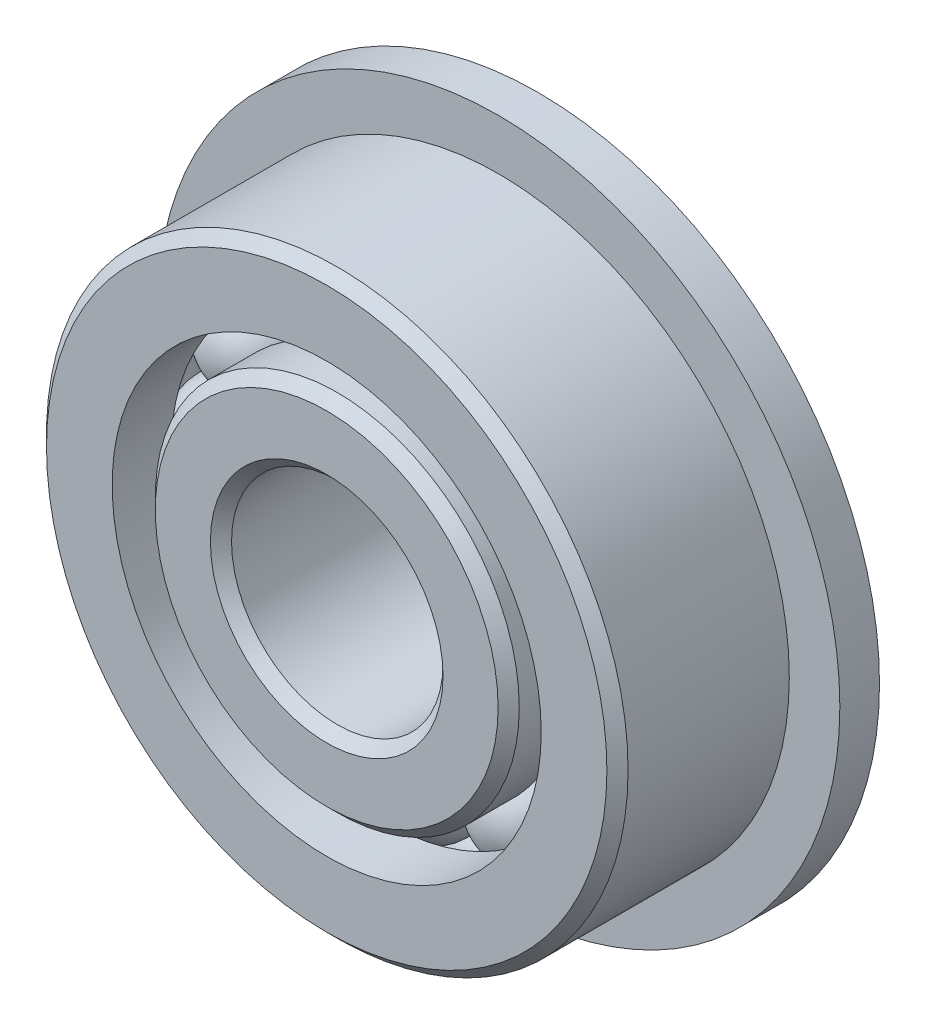
from build123d import *

# Parameters (mm, degrees)
CIRPATTERN1_COUNT = 12
SKETCH6_W         = 1.190625
SKETCH6_H         = 3.807313462


with BuildPart() as part:
    # Sketch1 → Revolve1 (revolve)
    with BuildSketch(Plane(origin=(0, 0, 0), x_dir=(0, 0, -1), z_dir=(1, 0, 0))):
        with BuildLine():
            Line((2.8575, 8.73125), (-2.8575, 8.73125))
            Line((-2.8575, 8.73125), (-3.175, 8.41375))
            Line((-3.175, 8.41375), (-3.175, 6.441586538))
            Line((-3.175, 6.441586538), (-1.411111111, 6.441586538))
            ThreePointArc((-1.411111111, 6.441586538), (0, 7.446386277), (1.411111111, 6.441586538))
            Line((1.411111111, 6.441586538), (3.175, 6.441586538))
            Line((3.175, 6.441586538), (3.175, 8.41375))
            Line((3.175, 8.41375), (2.8575, 8.73125))
        make_face()
    revolve(axis=Axis((0, 0, 3.175), (0, 0, -1)))

    # Sketch6 → Revolve6 (revolve)
    with BuildSketch(Plane(origin=(0, 0, 0), x_dir=(0, 0, -1), z_dir=(1, 0, 0))):
        with Locations((2.5796875, 8.345243269)):
            Rectangle(SKETCH6_W, SKETCH6_H)
    revolve(axis=Axis((0, 0, -3.175), (0, 0, 1)))


with BuildPart() as body_2:
    # Sketch3 → Revolve3 (revolve)
    with BuildSketch(Plane(origin=(0, 0, 0), x_dir=(0, 0, -1), z_dir=(1, 0, 0))):
        with BuildLine():
            Line((-3.175, 3.4925), (-3.175, 5.147163462))
            Line((-3.175, 5.147163462), (-2.8575, 5.464663462))
            Line((-2.8575, 5.464663462), (-1.411111111, 5.464663462))
            ThreePointArc((-1.411111111, 5.464663462), (0, 4.459863723), (1.411111111, 5.464663462))
            Line((1.411111111, 5.464663462), (4.445, 5.464663462))
            Line((4.445, 5.464663462), (4.7625, 5.147163462))
            Line((4.7625, 5.147163462), (4.7625, 3.4925))
            Line((4.7625, 3.4925), (4.445, 3.175))
            Line((4.445, 3.175), (-2.8575, 3.175))
            Line((-2.8575, 3.175), (-3.175, 3.4925))
        make_face()
    revolve(axis=Axis((0, 0, 3.175), (0, 0, -1)))


with BuildPart() as body_3:
    # Sketch4 → Revolve4 (revolve)
    with BuildSketch(Plane(origin=(0, 0, 0), x_dir=(0, 0, -1), z_dir=(1, 0, 0))):
        with BuildLine():
            Line((-1.493261277, 5.953125), (1.493261277, 5.953125))
            ThreePointArc((1.493261277, 5.953125), (0, 7.446386277), (-1.493261277, 5.953125))
        make_face()
    revolve(axis=Axis((0, 5.953125, 1.493261277), (0, 0, -1)))


with BuildPart() as cirpattern1_1:
    # CirPattern1: pattern copy
    add(body_3.part.rotate(Axis((0, 0, -3.175), (0, 0, 1)), 1 * 360 / CIRPATTERN1_COUNT))


with BuildPart() as cirpattern1_2:
    # CirPattern1: pattern copy
    add(body_3.part.rotate(Axis((0, 0, -3.175), (0, 0, 1)), 2 * 360 / CIRPATTERN1_COUNT))


with BuildPart() as cirpattern1_3:
    # CirPattern1: pattern copy
    add(body_3.part.rotate(Axis((0, 0, -3.175), (0, 0, 1)), 3 * 360 / CIRPATTERN1_COUNT))


with BuildPart() as cirpattern1_4:
    # CirPattern1: pattern copy
    add(body_3.part.rotate(Axis((0, 0, -3.175), (0, 0, 1)), 4 * 360 / CIRPATTERN1_COUNT))


with BuildPart() as cirpattern1_5:
    # CirPattern1: pattern copy
    add(body_3.part.rotate(Axis((0, 0, -3.175), (0, 0, 1)), 5 * 360 / CIRPATTERN1_COUNT))


with BuildPart() as cirpattern1_6:
    # CirPattern1: pattern copy
    add(body_3.part.rotate(Axis((0, 0, -3.175), (0, 0, 1)), 6 * 360 / CIRPATTERN1_COUNT))


with BuildPart() as cirpattern1_7:
    # CirPattern1: pattern copy
    add(body_3.part.rotate(Axis((0, 0, -3.175), (0, 0, 1)), 7 * 360 / CIRPATTERN1_COUNT))


with BuildPart() as cirpattern1_8:
    # CirPattern1: pattern copy
    add(body_3.part.rotate(Axis((0, 0, -3.175), (0, 0, 1)), 8 * 360 / CIRPATTERN1_COUNT))


with BuildPart() as cirpattern1_9:
    # CirPattern1: pattern copy
    add(body_3.part.rotate(Axis((0, 0, -3.175), (0, 0, 1)), 9 * 360 / CIRPATTERN1_COUNT))


with BuildPart() as cirpattern1_10:
    # CirPattern1: pattern copy
    add(body_3.part.rotate(Axis((0, 0, -3.175), (0, 0, 1)), 10 * 360 / CIRPATTERN1_COUNT))


with BuildPart() as cirpattern1_11:
    # CirPattern1: pattern copy
    add(body_3.part.rotate(Axis((0, 0, -3.175), (0, 0, 1)), 11 * 360 / CIRPATTERN1_COUNT))


solid = Compound([part.part, body_2.part, body_3.part, cirpattern1_1.part, cirpattern1_2.part, cirpattern1_3.part, cirpattern1_4.part, cirpattern1_5.part, cirpattern1_6.part, cirpattern1_7.part, cirpattern1_8.part, cirpattern1_9.part, cirpattern1_10.part, cirpattern1_11.part])
